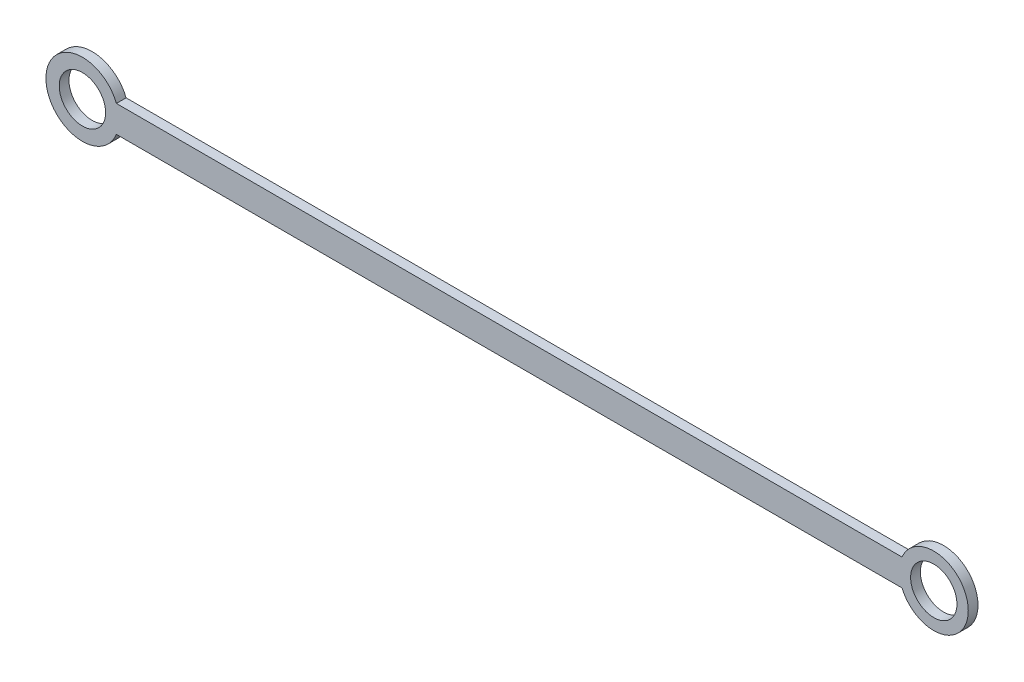
from build123d import *

# Parameters (mm, degrees)
SKETCH_1_R      = 9.53
EXTRUDE_1_DEPTH = 4


with BuildPart() as part:
    # 草图1 → 凸台-拉伸1 (new body)
    with BuildSketch(Plane.XY):
        with BuildLine():
            Line((13.955285737, 5.5), (336.935519652, 5.5))
            ThreePointArc((336.935519652, 5.5), (364.175000767, 0), (336.935519652, -5.5))
            Line((336.935519652, -5.5), (13.955285737, -5.5))
            ThreePointArc((13.955285737, -5.5), (-15, 0), (13.955285737, 5.5))
        make_face()
        Circle(SKETCH_1_R, mode=Mode.SUBTRACT)
        with Locations(Location((350, 0, 0), (0, 0, 180))):
            Circle(SKETCH_1_R, mode=Mode.SUBTRACT)
    extrude(amount=EXTRUDE_1_DEPTH)


solid = part.part
